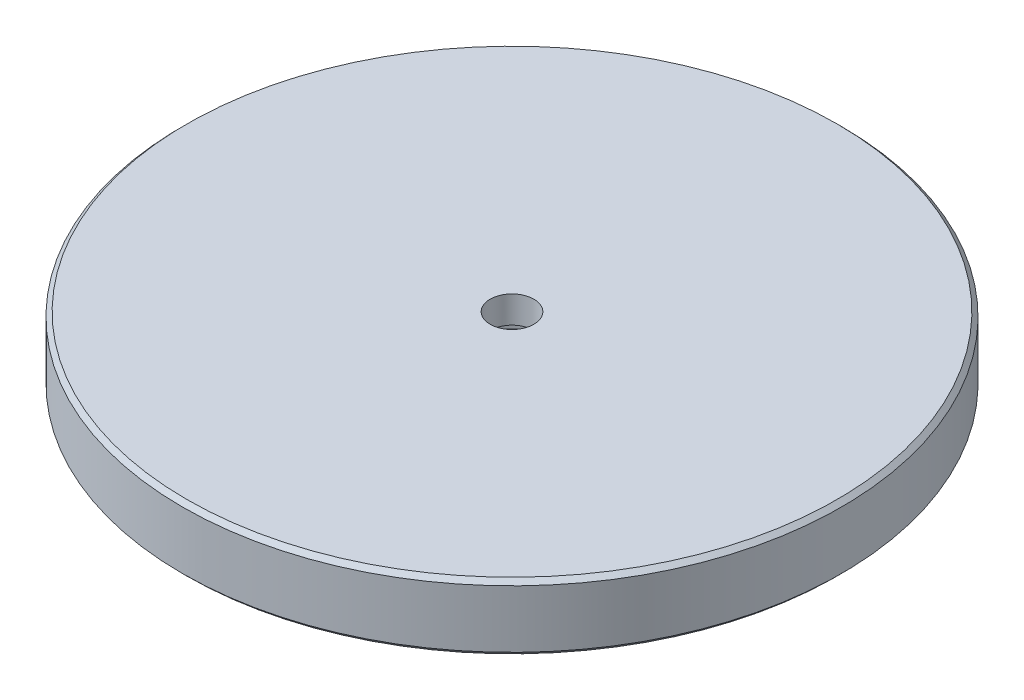
from build123d import *

# Parameters (mm, degrees)
SKETCH1_R           = 75.5
BOSS_EXTRUDE1_DEPTH = 15.2
SKETCH2_R           = 15.2
CUT_EXTRUDE1_DEPTH  = 9
CHAMFER1_SIZE       = 1
SKETCH4_R           = 5
CUT_EXTRUDE2_DEPTH  = 28
CHAMFER2_SIZE       = 1


with BuildPart() as part:
    # Sketch1 → Boss-Extrude1 (new body)
    with BuildSketch(Plane(origin=(0, 0, 0), x_dir=(1, 0, 0), z_dir=(0, 1, 0))):
        with Locations(Location((0, 0, 0), (0, 0, 90))):
            Circle(SKETCH1_R)
    extrude(amount=BOSS_EXTRUDE1_DEPTH)

    # Sketch2 → Cut-Extrude1 (cut)
    with BuildSketch(Plane.XZ):
        with Locations(Location((0, 0, 0), (0, 0, 270))):
            Circle(SKETCH2_R)
    extrude(amount=-CUT_EXTRUDE1_DEPTH, mode=Mode.SUBTRACT)

    # Chamfer1
    chamfer1_edges = [part.edges().sort_by_distance(p)[0] for p in [
        (0, 0, 15.2),
    ]]
    chamfer(chamfer1_edges, length=CHAMFER1_SIZE)

    # Sketch4 → Cut-Extrude2 (cut)
    with BuildSketch(Plane.XZ.offset(-9)):
        with Locations(Location((0, 0, 0), (0, 0, 270))):
            Circle(SKETCH4_R)
    extrude(amount=-CUT_EXTRUDE2_DEPTH, mode=Mode.SUBTRACT)

    # Chamfer2
    chamfer2_edges = [part.edges().sort_by_distance(p)[0] for p in [
        (0, 0, 75.5),
        (0, 15.2, 75.5),
    ]]
    chamfer(chamfer2_edges, length=CHAMFER2_SIZE)


solid = part.part
